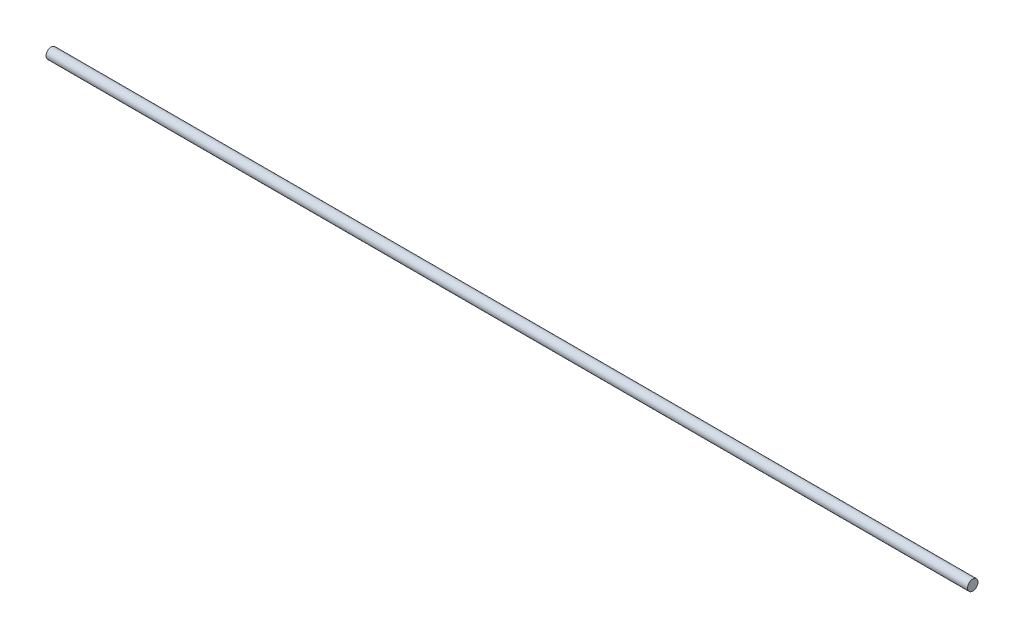
from build123d import *

# Parameters (mm, degrees)
SKETCH3_R           = 6.35
BOSS_EXTRUDE1_DEPTH = 1122.137625954


with BuildPart() as part:
    # Sketch3 → Boss-Extrude1 (new body)
    with BuildSketch(Plane(origin=(0, 0, 0), x_dir=(0, 0, -1), z_dir=(1, 0, 0))):
        Circle(SKETCH3_R)
    extrude(amount=BOSS_EXTRUDE1_DEPTH)


solid = part.part
